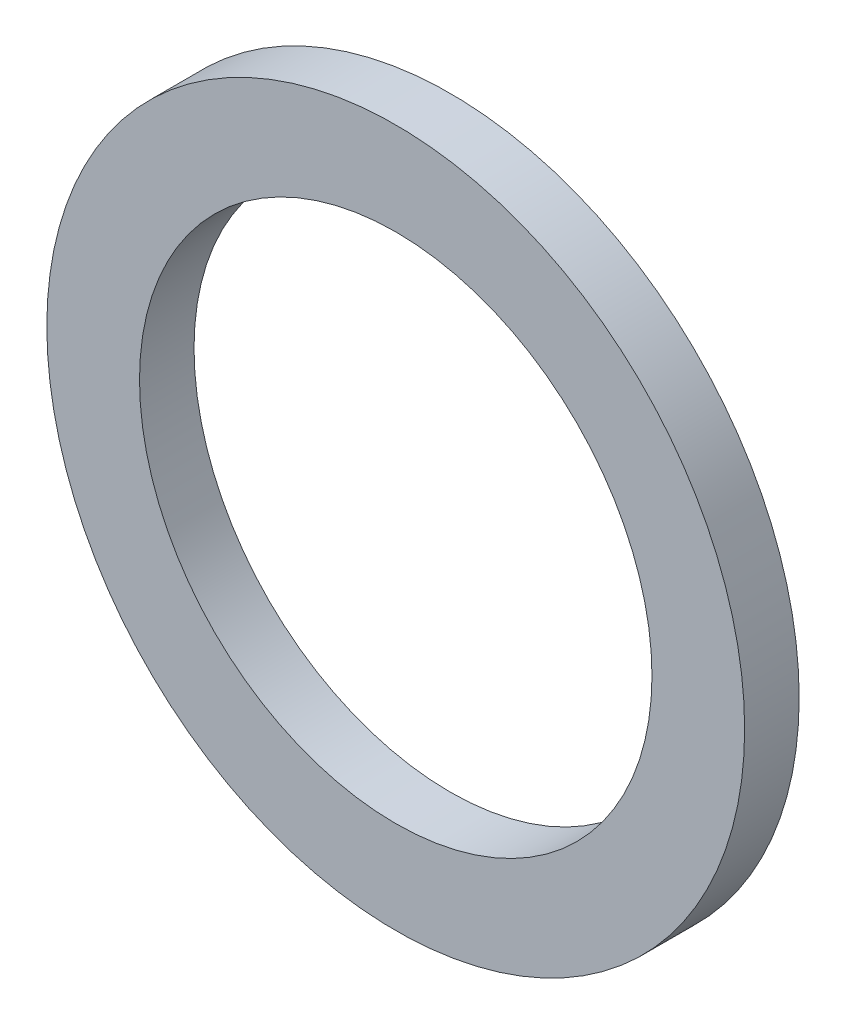
from build123d import *

# Parameters (mm, degrees)
SKETCH_1_R      = 3.2
SKETCH_1_R_2    = 2.35
EXTRUDE_1_DEPTH = 0.5


with BuildPart() as part:
    # 草图1 → 凸台-拉伸1 (new body)
    with BuildSketch(Plane.XY):
        Circle(SKETCH_1_R)
        Circle(SKETCH_1_R_2, mode=Mode.SUBTRACT)
    extrude(amount=EXTRUDE_1_DEPTH)


solid = part.part
